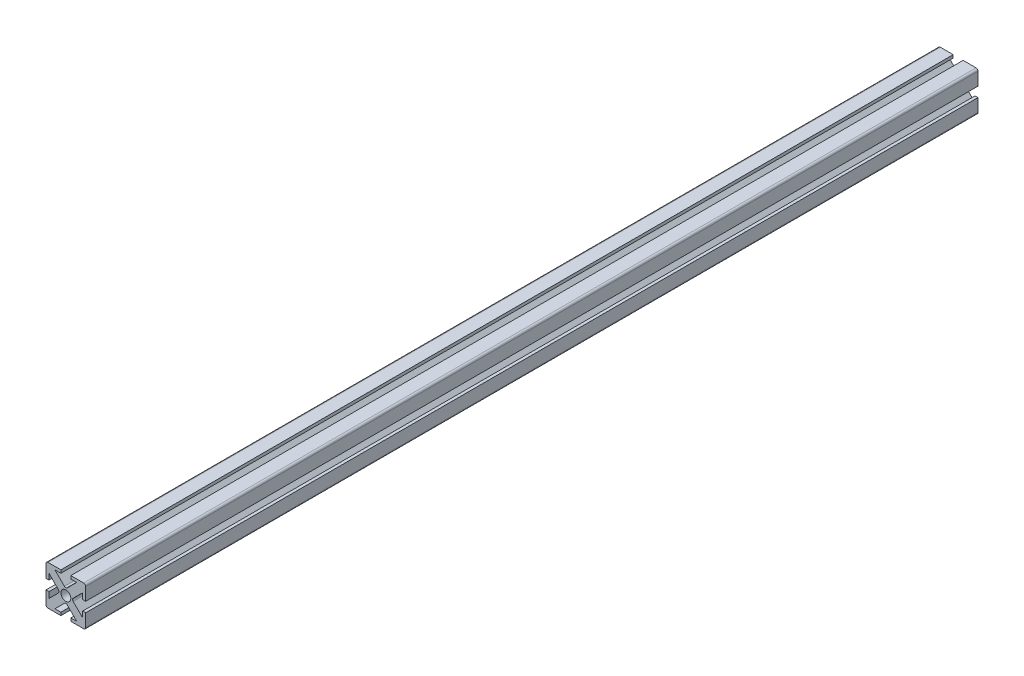
from build123d import *

# Parameters (mm, degrees)
SKETCH_1_R      = 2500
EXTRUDE_1_DEPTH = 450000
FILLET_1_R      = 1000
FILLET_2_R      = 1000


with BuildPart() as part:
    # 草圖1 → 填料-伸長1 (new body)
    with BuildSketch(Plane.XY):
        Polygon((-2500, 10000), (-2500, 8500), (-5500, 8500), (0, 3000), (5500, 8500), (2500, 8500), (2500, 10000), (10000, 10000), (10000, 2500), (8500, 2500), (8500, 5500), (3000, 0), (8500, -5500), (8500, -2500), (10000, -2500), (10000, -10000), (2500, -10000), (2500, -8500), (5500, -8500), (0, -3000), (-5500, -8500), (-2500, -8500), (-2500, -10000), (-10000, -10000), (-10000, -2500), (-8500, -2500), (-8500, -5500), (-3000, 0), (-8500, 5500), (-8500, 2500), (-10000, 2500), (-10000, 10000), align=None)
        Circle(SKETCH_1_R, mode=Mode.SUBTRACT)
    extrude(amount=EXTRUDE_1_DEPTH)

    # 圓角1
    fillet_1_edges = [part.edges().sort_by_distance(p)[0] for p in [
        (0, -3000, 225000),
        (-3000, 0, 225000),
        (0, 3000, 225000),
        (3000, 0, 225000),
    ]]
    fillet(fillet_1_edges, radius=FILLET_1_R)

    # 圓角2
    fillet_2_edges = [part.edges().sort_by_distance(p)[0] for p in [
        (-10000, -10000, 225000),
        (-10000, 10000, 225000),
        (10000, 10000, 225000),
        (10000, -10000, 225000),
    ]]
    fillet(fillet_2_edges, radius=FILLET_2_R)


solid = part.part
